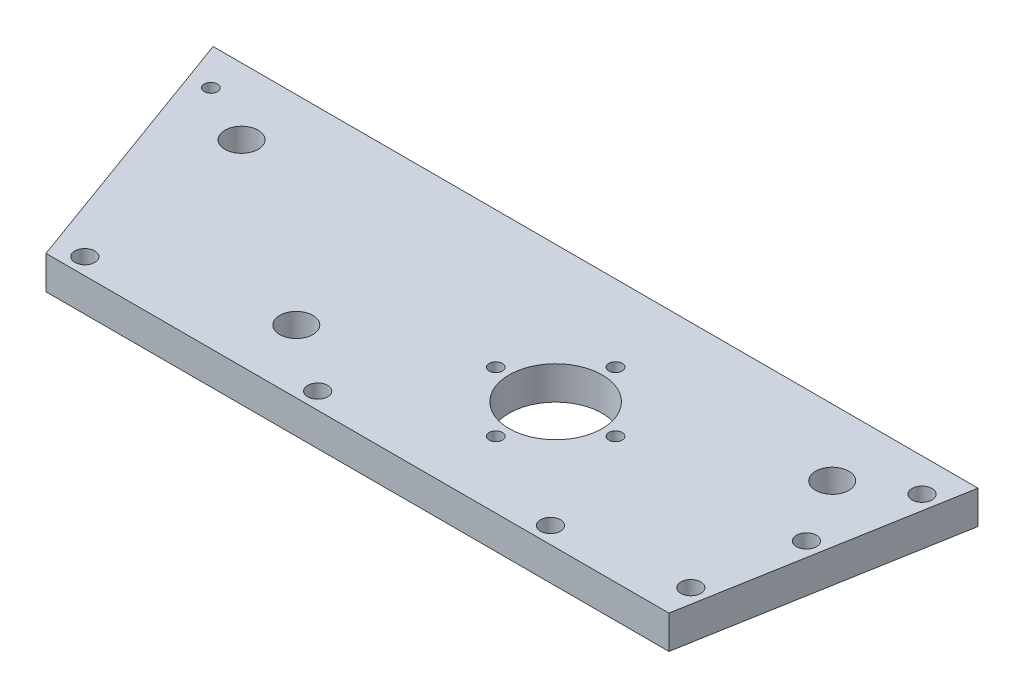
from build123d import *

# Parameters (mm, degrees)
BOSS_EXTRUDE2_DEPTH = 5
SKETCH2_R           = 2.5
CUT_EXTRUDE1_DEPTH  = 5
SKETCH3_R           = 7
SKETCH3_R_2         = 1
CUT_EXTRUDE2_DEPTH  = 90.644870735
SKETCH4_R           = 1.5
CUT_EXTRUDE3_DEPTH  = 90.644870735
SKETCH5_R           = 1
CUT_EXTRUDE4_DEPTH  = 90.644870735


with BuildPart() as part:
    # Sketch1 → Boss-Extrude2 (new body)
    with BuildSketch(Plane(origin=(0, 0, 0), x_dir=(-1, 0, 0), z_dir=(0, 1, 0))):
        Polygon((-72.491053579, -52.5), (42.508946421, -52.5), (28.132122167, -13), (-65.526137841, -13), align=None)
    extrude(amount=BOSS_EXTRUDE2_DEPTH)

    # Sketch2 → Cut-Extrude1 (cut)
    with BuildSketch(Plane(origin=(0, 5, 0), x_dir=(-1, 0, 0), z_dir=(0, 1, 0))):
        with Locations(Location((28.227466353, -42.5, 0), (0, 0, 90))):
            Circle(SKETCH2_R)
        with Locations(Location((0, -22.5, 0), (0, 0, 90))):
            Circle(SKETCH2_R)
        with Locations(Location((-60.573517653, -42.5, 0), (0, 0, 90))):
            Circle(SKETCH2_R)
    extrude(amount=-CUT_EXTRUDE1_DEPTH, mode=Mode.SUBTRACT)

    # Sketch3 → Cut-Extrude2 (cut, through all)
    with BuildSketch(Plane(origin=(0, 5, 0), x_dir=(1, 0, 0), z_dir=(0, 1, 0))):
        with Locations(Location((29.491053579, 32, 0), (0, 0, 270))):
            Circle(SKETCH3_R)
        with Locations(Location((20.491053579, 32, 0), (0, 0, 270))):
            Circle(SKETCH3_R_2)
        with Locations(Location((29.491053579, 41, 0), (0, 0, 270))):
            Circle(SKETCH3_R_2)
        with Locations(Location((38.491053579, 32, 0), (0, 0, 270))):
            Circle(SKETCH3_R_2)
        with Locations(Location((29.491053579, 23, 0), (0, 0, 270))):
            Circle(SKETCH3_R_2)
    extrude(amount=-CUT_EXTRUDE2_DEPTH, mode=Mode.SUBTRACT)

    # Sketch4 → Cut-Extrude3 (cut, through all)
    with BuildSketch(Plane.XZ):
        with Locations(Location((-24.785336663, -15.5, 0), (0, 0, 270))):
            Circle(SKETCH4_R)
        with Locations(Location((10.214663337, -15.5, 0), (0, 0, 270))):
            Circle(SKETCH4_R)
        with Locations(Location((45.214663337, -15.5, 0), (0, 0, 270))):
            Circle(SKETCH4_R)
        with Locations(Location((63.861406816, -17.95576741, 0), (0, 0, 270))):
            Circle(SKETCH4_R)
        with Locations(Location((66.466129481, -32.727883705, 0), (0, 0, 270))):
            Circle(SKETCH4_R)
        with Locations(Location((69.070852146, -47.5, 0), (0, 0, 270))):
            Circle(SKETCH4_R)
    extrude(amount=-CUT_EXTRUDE3_DEPTH, mode=Mode.SUBTRACT)

    # Sketch5 → Cut-Extrude4 (cut, through all)
    with BuildSketch(Plane(origin=(0, 5, 0), x_dir=(-1, 0, 0), z_dir=(0, 1, 0))):
        with Locations(Location((37.295727555, -46.948212084, 0), (0, 0, 90))):
            Circle(SKETCH5_R)
    extrude(amount=-CUT_EXTRUDE4_DEPTH, mode=Mode.SUBTRACT)


solid = part.part
